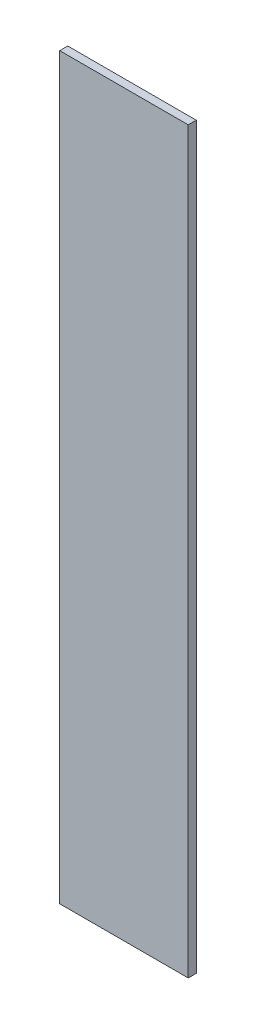
from build123d import *

# Parameters (mm, degrees)
SKETCH1_W           = 50.8
SKETCH1_H           = 292.1
BOSS_EXTRUDE1_DEPTH = 3.175


with BuildPart() as part:
    # Sketch1 → Boss-Extrude1 (new body)
    with BuildSketch(Plane.XY):
        with Locations((25.4, 146.05)):
            Rectangle(SKETCH1_W, SKETCH1_H)
    extrude(amount=BOSS_EXTRUDE1_DEPTH)


solid = part.part
